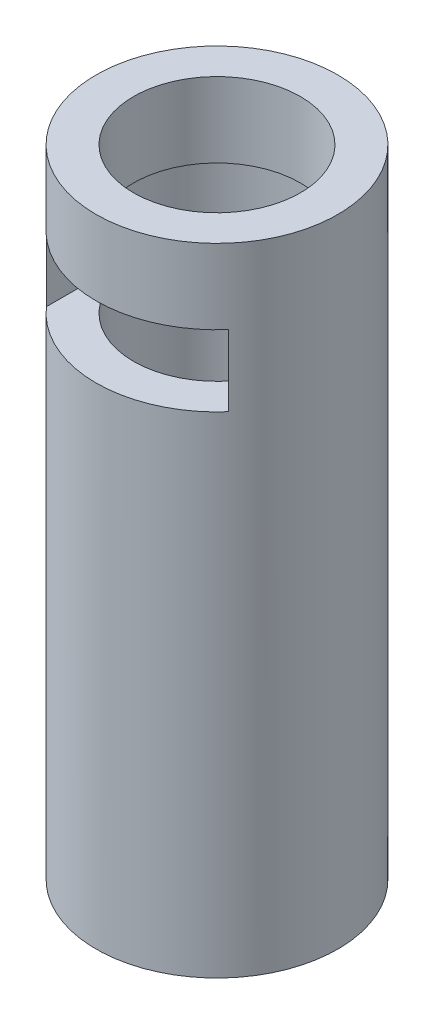
from build123d import *

# Parameters (mm, degrees)
SKETCH1_R           = 16.15
SKETCH1_R_2         = 11.15
BOSS_EXTRUDE1_DEPTH = 80
BOSS_EXTRUDE2_START = 5
SKETCH2_R           = 16.15
SKETCH2_R_2         = 9.15
BOSS_EXTRUDE2_DEPTH = 5
CUT_EXTRUDE1_DEPTH  = 9.5


with BuildPart() as part:
    # Sketch1 → Boss-Extrude1 (new body)
    with BuildSketch(Plane(origin=(0, 0, 0), x_dir=(1, 0, 0), z_dir=(0, 1, 0))):
        with Locations(Location((0, 0, 0), (0, 0, 270))):
            Circle(SKETCH1_R)
        with Locations(Location((0, 0, 0), (0, 0, 270))):
            Circle(SKETCH1_R_2, mode=Mode.SUBTRACT)
    extrude(amount=BOSS_EXTRUDE1_DEPTH)

    # Sketch2 → Boss-Extrude2 (add)
    with BuildSketch(Plane.XZ.offset(BOSS_EXTRUDE2_START)):
        with Locations(Location((0, 0, 0), (0, 0, 270))):
            Circle(SKETCH2_R)
        with Locations(Location((0, 0, 0), (0, 0, 270))):
            Circle(SKETCH2_R_2, mode=Mode.SUBTRACT)
    extrude(amount=-BOSS_EXTRUDE2_DEPTH)

    # Sketch4 → Cut-Extrude1 (cut)
    with BuildSketch(Plane(origin=(0, 70, 0), x_dir=(1, 0, 0), z_dir=(0, 1, 0))):
        with BuildLine():
            Line((-12.15, 0), (-12.15, -18.126783329))
            Line((-12.15, -18.126783329), (12.15, -18.126783329))
            Line((12.15, -18.126783329), (12.15, 0))
            ThreePointArc((12.15, 0), (0, 12.15), (-12.15, 0))
        make_face()
    extrude(amount=-CUT_EXTRUDE1_DEPTH, mode=Mode.SUBTRACT)


solid = part.part
